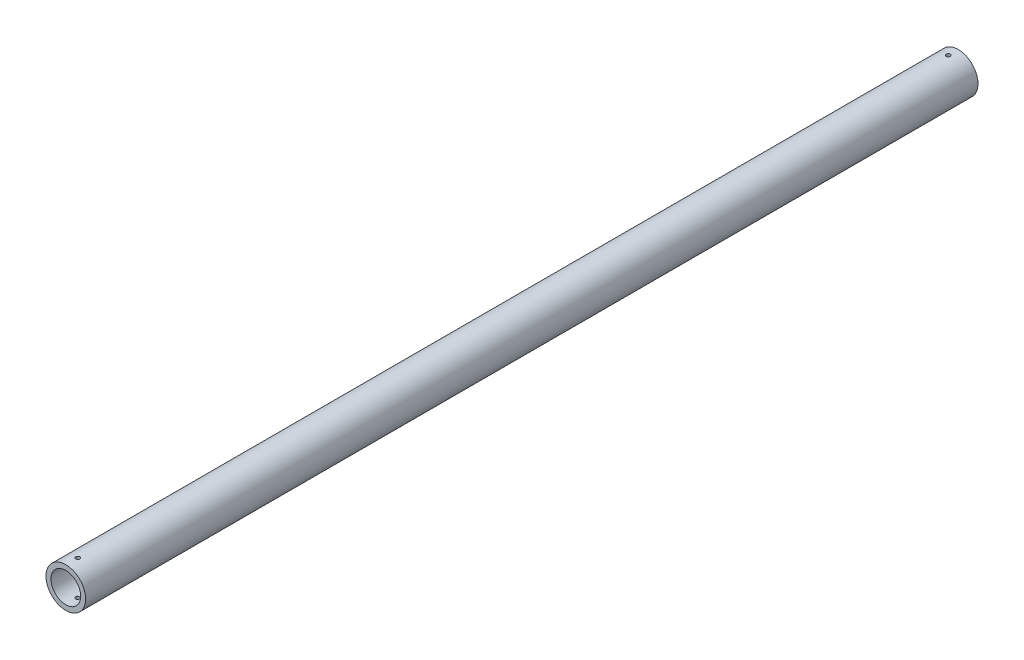
from build123d import *

# Parameters (mm, degrees)
SKETCH_1_R          = 10
SKETCH_1_R_2        = 7.5
EXTRUDE_1_DEPTH     = 450
SKETCH_2_R          = 1
CUT_EXTRUDE_2_DEPTH = 20
SKETCH_3_R          = 1
CUT_EXTRUDE_3_DEPTH = 20


with BuildPart() as part:
    # Эскиз1 → Вытянуть1 (new body)
    with BuildSketch(Plane.XY):
        Circle(SKETCH_1_R)
        Circle(SKETCH_1_R_2, mode=Mode.SUBTRACT)
    extrude(amount=EXTRUDE_1_DEPTH)

    # Эскиз2 → Вытянуть2 (cut, symmetric)
    with BuildSketch(Plane(origin=(0, 0, 0), x_dir=(1, 0, 0), z_dir=(0, 1, 0))):
        with Locations(Location((0, -5, 0), (0, 0, 270))):
            Circle(SKETCH_2_R)
    extrude(amount=CUT_EXTRUDE_2_DEPTH, both=True, mode=Mode.SUBTRACT)

    # Эскиз3 → Вытянуть3 (cut, symmetric)
    with BuildSketch(Plane(origin=(0, 0, 0), x_dir=(1, 0, 0), z_dir=(0, 1, 0))):
        with Locations(Location((0, -444, 0), (0, 0, 270))):
            Circle(SKETCH_3_R)
    extrude(amount=CUT_EXTRUDE_3_DEPTH, both=True, mode=Mode.SUBTRACT)


solid = part.part
